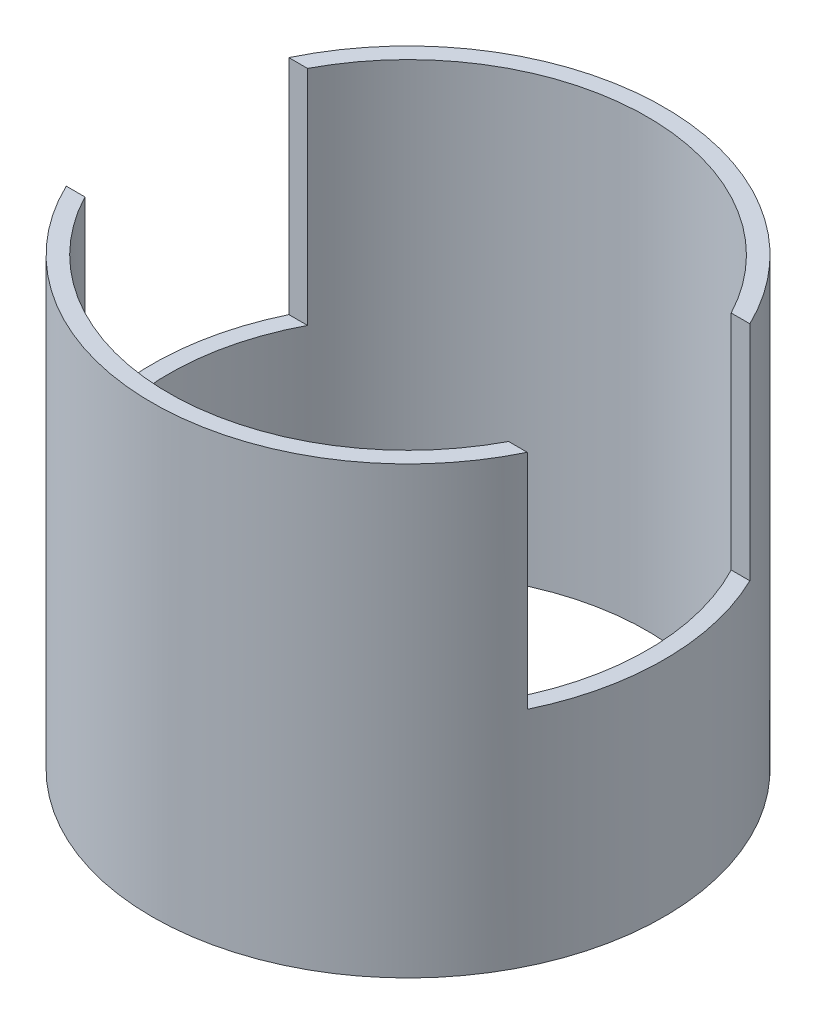
from build123d import *

# Parameters (mm, degrees)
SKETCH1_R           = 23
SKETCH1_R_2         = 21.5
BOSS_EXTRUDE1_DEPTH = 40
SKETCH2_W           = 60
SKETCH2_H           = 20
CUT_EXTRUDE1_DEPTH  = 20


with BuildPart() as part:
    # Sketch1 → Boss-Extrude1 (new body)
    with BuildSketch(Plane(origin=(0, 0, 0), x_dir=(1, 0, 0), z_dir=(0, 1, 0))):
        with Locations(Location((0, 0, 0), (0, 0, 270))):
            Circle(SKETCH1_R)
        with Locations(Location((0, 0, 0), (0, 0, 270))):
            Circle(SKETCH1_R_2, mode=Mode.SUBTRACT)
    extrude(amount=BOSS_EXTRUDE1_DEPTH)

    # Sketch2 → Cut-Extrude1 (cut)
    with BuildSketch(Plane(origin=(0, 40, 0), x_dir=(1, 0, 0), z_dir=(0, 1, 0))):
        Rectangle(SKETCH2_W, SKETCH2_H)
    extrude(amount=-CUT_EXTRUDE1_DEPTH, mode=Mode.SUBTRACT)


solid = part.part
